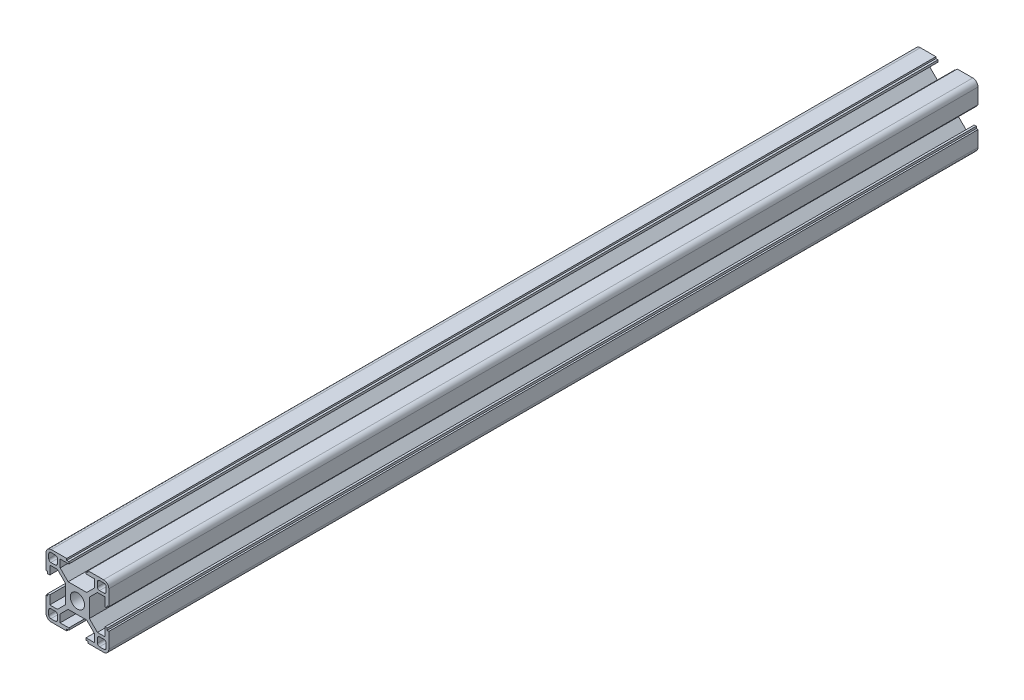
from build123d import *

# Parameters (mm, degrees)
SKETCH1_R      = 3.4
EXTRUDE1_DEPTH = 415
EXTRUDE2_DEPTH = 416.541814984


with BuildPart() as part:
    # Sketch1 → Extrude1 (new body)
    with BuildSketch(Plane.XY):
        with BuildLine():
            Line((-5.1, 14.2), (-5.1, 15))
            Line((-5.1, 15), (-12.5, 15))
            ThreePointArc((-12.5, 15), (-14.267766953, 14.267766953), (-15, 12.5))
            Line((-15, 12.5), (-15, 5.1))
            Line((-15, 5.1), (-14.2, 5.1))
            Line((-14.2, 5.1), (-14.2, 4.1))
            Line((-14.2, 4.1), (-13.2, 4.1))
            Line((-13.2, 4.1), (-13.2, 8.25))
            Line((-13.2, 8.25), (-9.522792206, 8.25))
            Line((-9.522792206, 8.25), (-5.7, 4.427207794))
            Line((-5.7, 4.427207794), (-5.7, -4.427207794))
            Line((-5.7, -4.427207794), (-9.522792206, -8.25))
            Line((-9.522792206, -8.25), (-13.2, -8.25))
            Line((-13.2, -8.25), (-13.2, -4.1))
            Line((-13.2, -4.1), (-14.2, -4.1))
            Line((-14.2, -4.1), (-14.2, -5.1))
            Line((-14.2, -5.1), (-15, -5.1))
            Line((-15, -5.1), (-15, -12.5))
            ThreePointArc((-15, -12.5), (-14.267766953, -14.267766953), (-12.5, -15))
            Line((-12.5, -15), (-5.1, -15))
            Line((-5.1, -15), (-5.1, -14.2))
            Line((-5.1, -14.2), (-4.1, -14.2))
            Line((-4.1, -14.2), (-4.1, -13.2))
            Line((-4.1, -13.2), (-8.25, -13.2))
            Line((-8.25, -13.2), (-8.25, -9.522792206))
            Line((-8.25, -9.522792206), (-4.427207794, -5.7))
            Line((-4.427207794, -5.7), (4.427207794, -5.7))
            Line((4.427207794, -5.7), (8.25, -9.522792206))
            Line((8.25, -9.522792206), (8.25, -13.2))
            Line((8.25, -13.2), (4.1, -13.2))
            Line((4.1, -13.2), (4.1, -14.2))
            Line((4.1, -14.2), (5.1, -14.2))
            Line((5.1, -14.2), (5.1, -15))
            Line((5.1, -15), (12.5, -15))
            ThreePointArc((12.5, -15), (14.267766953, -14.267766953), (15, -12.5))
            Line((15, -12.5), (15, -5.1))
            Line((15, -5.1), (14.2, -5.1))
            Line((14.2, -5.1), (14.2, -4.1))
            Line((14.2, -4.1), (13.2, -4.1))
            Line((13.2, -4.1), (13.2, -8.25))
            Line((13.2, -8.25), (9.522792206, -8.25))
            Line((9.522792206, -8.25), (5.7, -4.427207794))
            Line((5.7, -4.427207794), (5.7, 4.427207794))
            Line((5.7, 4.427207794), (9.522792206, 8.25))
            Line((9.522792206, 8.25), (13.2, 8.25))
            Line((13.2, 8.25), (13.2, 4.1))
            Line((13.2, 4.1), (14.2, 4.1))
            Line((14.2, 4.1), (14.2, 5.1))
            Line((14.2, 5.1), (15, 5.1))
            Line((15, 5.1), (15, 12.5))
            ThreePointArc((15, 12.5), (14.267766953, 14.267766953), (12.5, 15))
            Line((12.5, 15), (5.1, 15))
            Line((5.1, 15), (5.1, 14.2))
            Line((5.1, 14.2), (4.1, 14.2))
            Line((4.1, 14.2), (4.1, 13.2))
            Line((4.1, 13.2), (8.25, 13.2))
            Line((8.25, 13.2), (8.25, 9.522792206))
            Line((8.25, 9.522792206), (4.427207794, 5.7))
            Line((4.427207794, 5.7), (-4.427207794, 5.7))
            Line((-4.427207794, 5.7), (-8.25, 9.522792206))
            Line((-8.25, 9.522792206), (-8.25, 13.2))
            Line((-8.25, 13.2), (-4.1, 13.2))
            Line((-4.1, 13.2), (-4.1, 14.2))
            Line((-4.1, 14.2), (-5.1, 14.2))
        make_face()
        Circle(SKETCH1_R, mode=Mode.SUBTRACT)
    extrude(amount=EXTRUDE1_DEPTH)

    # Sketch2 → Extrude2 (cut, through all)
    with BuildSketch(Plane.XY.offset(415)):
        with BuildLine():
            Line((13.7, 12.7), (13.7, 10.55))
            ThreePointArc((13.7, 10.55), (13.407106781, 9.842893219), (12.7, 9.55))
            Line((12.7, 9.55), (10.55, 9.55))
            ThreePointArc((10.55, 9.55), (9.842893219, 9.842893219), (9.55, 10.55))
            Line((9.55, 10.55), (9.55, 12.7))
            ThreePointArc((9.55, 12.7), (9.842893219, 13.407106781), (10.55, 13.7))
            Line((10.55, 13.7), (12.7, 13.7))
            ThreePointArc((12.7, 13.7), (13.407106781, 13.407106781), (13.7, 12.7))
        make_face()
        with BuildLine():
            Line((-12.7, 13.7), (-10.55, 13.7))
            ThreePointArc((-10.55, 13.7), (-9.842893219, 13.407106781), (-9.55, 12.7))
            Line((-9.55, 12.7), (-9.55, 10.55))
            ThreePointArc((-9.55, 10.55), (-9.842893219, 9.842893219), (-10.55, 9.55))
            Line((-10.55, 9.55), (-12.7, 9.55))
            ThreePointArc((-12.7, 9.55), (-13.407106781, 9.842893219), (-13.7, 10.55))
            Line((-13.7, 10.55), (-13.7, 12.7))
            ThreePointArc((-13.7, 12.7), (-13.407106781, 13.407106781), (-12.7, 13.7))
        make_face()
        with BuildLine():
            Line((12.7, -13.7), (10.55, -13.7))
            ThreePointArc((10.55, -13.7), (9.842893219, -13.407106781), (9.55, -12.7))
            Line((9.55, -12.7), (9.55, -10.55))
            ThreePointArc((9.55, -10.55), (9.842893219, -9.842893219), (10.55, -9.55))
            Line((10.55, -9.55), (12.7, -9.55))
            ThreePointArc((12.7, -9.55), (13.407106781, -9.842893219), (13.7, -10.55))
            Line((13.7, -10.55), (13.7, -12.7))
            ThreePointArc((13.7, -12.7), (13.407106781, -13.407106781), (12.7, -13.7))
        make_face()
        with BuildLine():
            Line((-13.7, -12.7), (-13.7, -10.55))
            ThreePointArc((-13.7, -10.55), (-13.407106781, -9.842893219), (-12.7, -9.55))
            Line((-12.7, -9.55), (-10.55, -9.55))
            ThreePointArc((-10.55, -9.55), (-9.842893219, -9.842893219), (-9.55, -10.55))
            Line((-9.55, -10.55), (-9.55, -12.7))
            ThreePointArc((-9.55, -12.7), (-9.842893219, -13.407106781), (-10.55, -13.7))
            Line((-10.55, -13.7), (-12.7, -13.7))
            ThreePointArc((-12.7, -13.7), (-13.407106781, -13.407106781), (-13.7, -12.7))
        make_face()
    extrude(amount=-EXTRUDE2_DEPTH, mode=Mode.SUBTRACT)


solid = part.part
